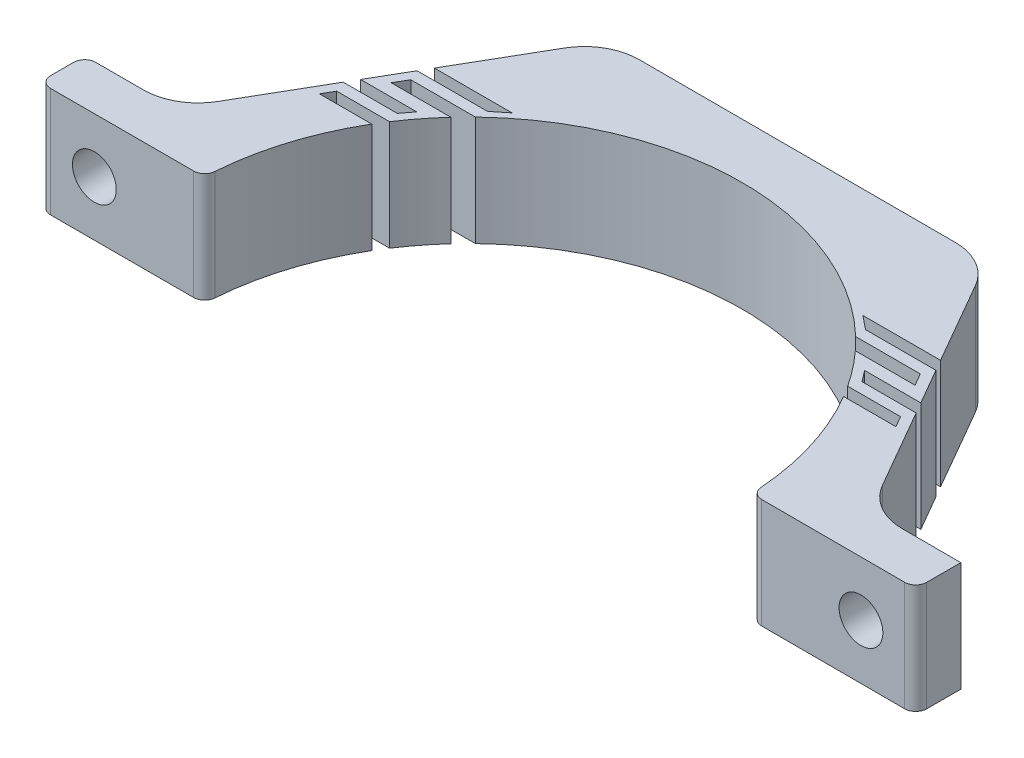
from build123d import *

# Parameters (mm, degrees)
EXTRUDE_1_DEPTH     = 10
SKETCH_2_R          = 2
CUT_EXTRUDE_1_DEPTH = 10


with BuildPart() as part:
    # 草图1 → 凸台-拉伸1 (new body)
    with BuildSketch(Plane(origin=(0, 0, 0), x_dir=(1, 0, 0), z_dir=(0, 1, 0))):
        with BuildLine():
            Line((-39, 0.885049463), (-25.931575126, 0.885049463))
            ThreePointArc((-25.931575126, 0.885049463), (-25.250583901, 1.152757888), (-24.934206852, 1.81254756))
            ThreePointArc((-24.934206852, 1.81254756), (-23.860011776, 7.463232411), (-21.522796165, 12.718853928))
            Line((-21.522796165, 12.718853928), (-26.30015626, 12.718853928))
            Line((-26.30015626, 12.718853928), (-25.721769935, 13.718853928))
            Line((-25.721769935, 13.718853928), (-20.899594419, 13.718853928))
            ThreePointArc((-20.899594419, 13.718853928), (-19.738763969, 15.342137953), (-18.45215564, 16.867659952))
            Line((-18.45215564, 16.867659952), (-23.900543591, 16.867659952))
            Line((-23.900543591, 16.867659952), (-23.245613592, 18))
            Line((-23.245613592, 18), (-17.349351573, 18))
            ThreePointArc((-17.349351573, 18), (0, 25), (17.349351573, 18))
            Line((17.349351573, 18), (23.245613592, 18))
            Line((23.245613592, 18), (23.900543591, 16.867659952))
            Line((23.900543591, 16.867659952), (18.45215564, 16.867659952))
            ThreePointArc((18.45215564, 16.867659952), (19.738763969, 15.342137953), (20.899594419, 13.718853928))
            Line((20.899594419, 13.718853928), (25.721769935, 13.718853928))
            Line((25.721769935, 13.718853928), (26.30015626, 12.718853928))
            Line((26.30015626, 12.718853928), (21.522796165, 12.718853928))
            ThreePointArc((21.522796165, 12.718853928), (23.865801222, 7.44469825), (24.936992355, 1.773812925))
            ThreePointArc((24.936992355, 1.773812925), (25.252344114, 1.113532593), (25.932918663, 0.844766649))
            Line((25.932918663, 0.844766649), (39.00132777, 0.82446634))
            ThreePointArc((39.00132777, 0.82446634), (39.708888674, 1.116260796), (40.002879949, 1.822911748))
            Line((40.002879949, 1.822911748), (40.00771867, 4.937858527))
            Line((40.00771867, 4.937858527), (34.656523892, 4.946171008))
            ThreePointArc((34.656523892, 4.946171008), (32.159247749, 5.618953494), (30.332223376, 7.44952891))
            Line((30.332223376, 7.44952891), (26.1380565, 14.727086916))
            Line((26.1380565, 14.727086916), (21.201804646, 14.727086916))
            Line((21.201804646, 14.727086916), (20.426778105, 15.735319903))
            Line((20.426778105, 15.735319903), (25.55547359, 15.735319903))
            Line((25.55547359, 15.735319903), (23.669823804, 18.999997983))
            Line((23.669823804, 18.999997983), (17.250673347, 18.999997983))
            Line((17.250673347, 18.999997983), (16.002596538, 19.999997983))
            Line((16.002596538, 19.999997983), (23.091437479, 19.999997983))
            Line((23.091437479, 19.999997983), (18.787180185, 27.482043412))
            ThreePointArc((18.787180185, 27.482043412), (16.958217309, 29.315990717), (14.457053173, 29.98878035))
            Line((14.457053173, 29.98878035), (-14.410451579, 30.011201553))
            ThreePointArc((-14.410451579, 30.011201553), (-16.910971111, 29.343270507), (-18.742519025, 27.514565487))
            Line((-18.742519025, 27.514565487), (-23.088840941, 20))
            Line((-23.088840941, 20), (-16, 20))
            Line((-16, 20), (-17.248076809, 19))
            Line((-17.248076809, 19), (-23.667227267, 19))
            Line((-23.667227267, 19), (-25.55547359, 15.735319903))
            Line((-25.55547359, 15.735319903), (-20.426778105, 15.735319903))
            Line((-20.426778105, 15.735319903), (-21.201804646, 14.727086916))
            Line((-21.201804646, 14.727086916), (-26.138621763, 14.727086916))
            Line((-26.138621763, 14.727086916), (-30.320614786, 7.496637574))
            ThreePointArc((-30.320614786, 7.496637574), (-32.150480545, 5.668902441), (-34.648798766, 5))
            Line((-34.648798766, 5), (-39, 5))
            ThreePointArc((-39, 5), (-39.707106781, 4.707106781), (-40, 4))
            Line((-40, 4), (-40, 1.885049463))
            ThreePointArc((-40, 1.885049463), (-39.707106781, 1.177942682), (-39, 0.885049463))
        make_face()
    extrude(amount=EXTRUDE_1_DEPTH)

    # 草图2 → 切除-拉伸1 (cut)
    with BuildSketch(Plane.XY):
        with Locations((35, 5)):
            Circle(SKETCH_2_R)
        with Locations(Location((-35, 5, 0), (0, 0, 79.886387813))):
            Circle(SKETCH_2_R)
    extrude(amount=-CUT_EXTRUDE_1_DEPTH, mode=Mode.SUBTRACT)


solid = part.part
